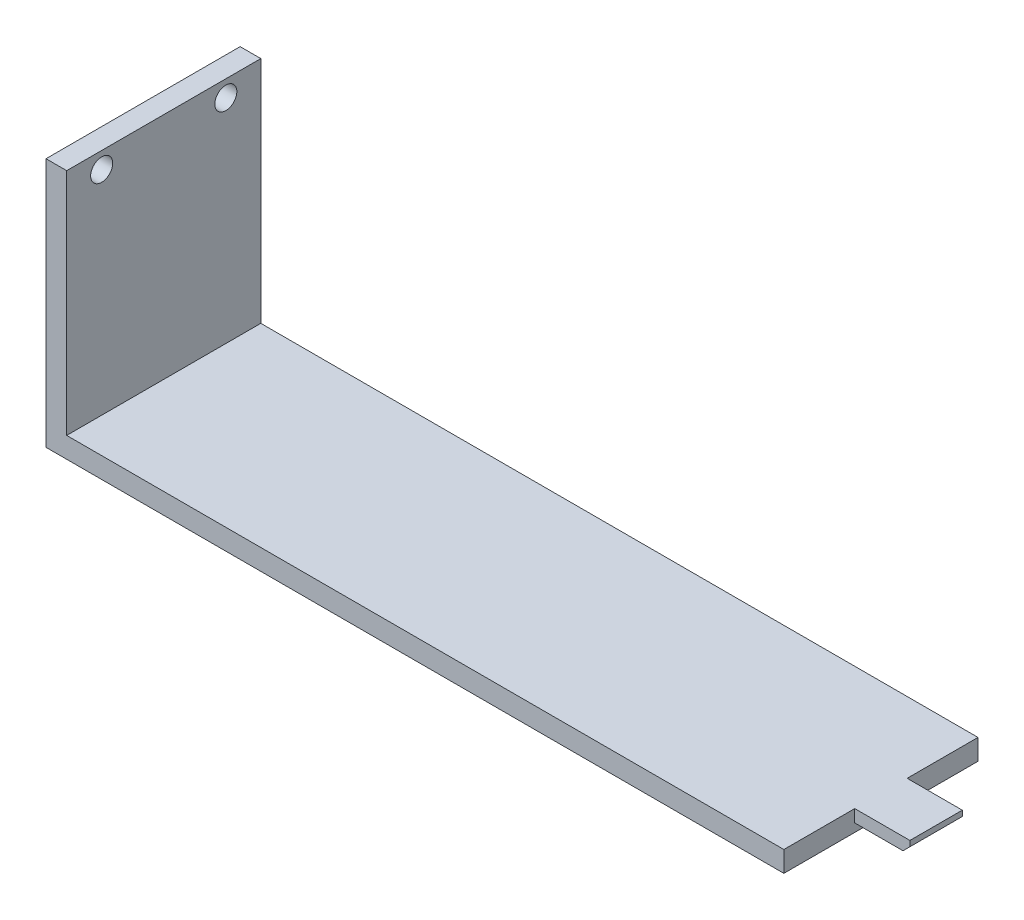
from build123d import *

# Parameters (mm, degrees)
SKETCH1_W           = 107
SKETCH1_H           = 28.15
BOSS_EXTRUDE1_DEPTH = 3
SKETCH2_W           = 7.6
SKETCH2_H           = 1.8
BOSS_EXTRUDE2_DEPTH = 8
CHAMFER1_SIZE       = 1
SKETCH3_W           = 3
SKETCH3_H           = 28.15
BOSS_EXTRUDE3_DEPTH = 33.25
SKETCH4_R           = 1.6
CUT_EXTRUDE1_DEPTH  = 33.25


with BuildPart() as part:
    # Sketch1 → Boss-Extrude1 (new body)
    with BuildSketch(Plane(origin=(0, 0, 0), x_dir=(1, 0, 0), z_dir=(0, 1, 0))):
        with Locations((3.889337641, -2.752705977)):
            Rectangle(SKETCH1_W, SKETCH1_H)
    extrude(amount=BOSS_EXTRUDE1_DEPTH)

    # Sketch2 → Boss-Extrude2 (add)
    with BuildSketch(Plane(origin=(57.389337641, 0, 0), x_dir=(0, 0, -1), z_dir=(1, 0, 0))):
        with Locations((-2.752705977, 2.1)):
            Rectangle(SKETCH2_W, SKETCH2_H)
    extrude(amount=BOSS_EXTRUDE2_DEPTH)

    # Chamfer1
    chamfer1_edges = [part.edges().sort_by_distance(p)[0] for p in [
        (65.389337641, 1.2, 2.752705977),
    ]]
    chamfer(chamfer1_edges, length=CHAMFER1_SIZE)

    # Sketch3 → Boss-Extrude3 (add)
    with BuildSketch(Plane(origin=(0, 3, 0), x_dir=(1, 0, 0), z_dir=(0, 1, 0))):
        with Locations((-48.110662359, -2.752705977)):
            Rectangle(SKETCH3_W, SKETCH3_H)
    extrude(amount=BOSS_EXTRUDE3_DEPTH)

    # Sketch4 → Cut-Extrude1 (cut)
    with BuildSketch(Plane.ZY.offset(49.610662359)):
        with Locations((-6.247294023, 33.85)):
            Circle(SKETCH4_R)
        with Locations((11.752705977, 33.85)):
            Circle(SKETCH4_R)
    extrude(amount=-CUT_EXTRUDE1_DEPTH, mode=Mode.SUBTRACT)


solid = part.part
